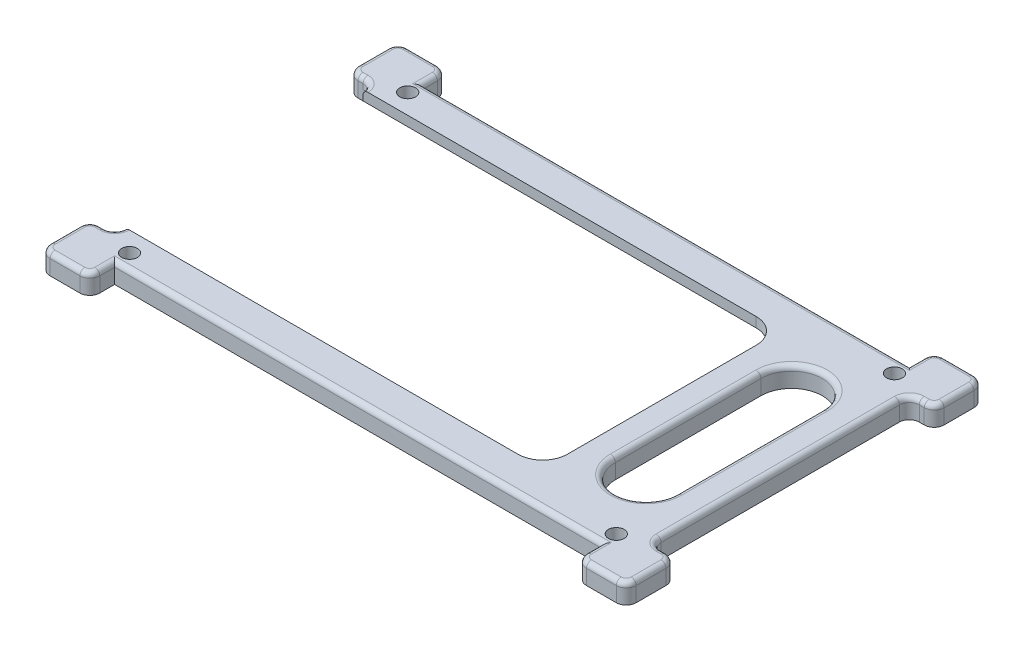
from build123d import *

# Parameters (mm, degrees)
CROQUIS2_R              = 1.5875
SALIENTE_EXTRUIR1_DEPTH = 4
CROQUIS3_W              = 6.440041964
CROQUIS3_H              = 2.682034213
CROQUIS3_W_2            = 39.119916072
CORTAR_EXTRUIR1_DEPTH   = 92
REDONDEO1_R             = 1


with BuildPart() as part:
    # Croquis2 → Saliente-Extruir1 (new body)
    with BuildSketch(Plane(origin=(0, 0, 0), x_dir=(1, 0, 0), z_dir=(0, 1, 0))):
        with BuildLine():
            Line((44.603152988, 28.432107171), (44.603152988, -19.567892829))
            ThreePointArc((44.603152988, -19.567892829), (45.188939426, -20.982106391), (46.603152988, -21.567892829))
            Line((46.603152988, -21.567892829), (47.603152988, -21.567892829))
            ThreePointArc((47.603152988, -21.567892829), (49.01736655, -22.153679266), (49.603152988, -23.567892829))
            Line((49.603152988, -23.567892829), (49.603152988, -29.567892829))
            ThreePointArc((49.603152988, -29.567892829), (49.01736655, -30.982106391), (47.603152988, -31.567892829))
            Line((47.603152988, -31.567892829), (41.603152988, -31.567892829))
            ThreePointArc((41.603152988, -31.567892829), (40.188939426, -30.982106391), (39.603152988, -29.567892829))
            Line((39.603152988, -29.567892829), (39.603152988, -29.067892829))
            Line((39.603152988, -29.067892829), (39.603152988, -26.567892829))
            Line((39.603152988, -26.567892829), (-58.396847012, -26.567892829))
            Line((-58.396847012, -26.567892829), (-58.396847012, -29.067892829))
            Line((-58.396847012, -29.067892829), (-58.396847012, -29.567892829))
            ThreePointArc((-58.396847012, -29.567892829), (-58.98263345, -30.982106391), (-60.396847012, -31.567892829))
            Line((-60.396847012, -31.567892829), (-66.396847012, -31.567892829))
            ThreePointArc((-66.396847012, -31.567892829), (-67.811060574, -30.982106391), (-68.396847012, -29.567892829))
            Line((-68.396847012, -29.567892829), (-68.396847012, -23.567892829))
            ThreePointArc((-68.396847012, -23.567892829), (-67.811060574, -22.153679266), (-66.396847012, -21.567892829))
            Line((-66.396847012, -21.567892829), (-65.396847012, -21.567892829))
            ThreePointArc((-65.396847012, -21.567892829), (-63.98263345, -20.982106391), (-63.396847012, -19.567892829))
            Line((-63.396847012, -19.567892829), (15.776989182, -19.567892829))
            ThreePointArc((15.776989182, -19.567892829), (19.312523088, -18.103426735), (20.776989182, -14.567892829))
            Line((20.776989182, -14.567892829), (20.776989182, 23.432107171))
            ThreePointArc((20.776989182, 23.432107171), (19.312523088, 26.967641077), (15.776989182, 28.432107171))
            Line((15.776989182, 28.432107171), (-63.396847012, 28.432107171))
            ThreePointArc((-63.396847012, 28.432107171), (-63.98263345, 29.846320734), (-65.396847012, 30.432107171))
            Line((-65.396847012, 30.432107171), (-66.396847012, 30.432107171))
            ThreePointArc((-66.396847012, 30.432107171), (-67.811060574, 31.017893609), (-68.396847012, 32.432107171))
            Line((-68.396847012, 32.432107171), (-68.396847012, 38.432107171))
            ThreePointArc((-68.396847012, 38.432107171), (-67.811060574, 39.846320734), (-66.396847012, 40.432107171))
            Line((-66.396847012, 40.432107171), (-60.396847012, 40.432107171))
            ThreePointArc((-60.396847012, 40.432107171), (-58.98263345, 39.846320734), (-58.396847012, 38.432107171))
            Line((-58.396847012, 38.432107171), (-58.396847012, 37.932107171))
            Line((-58.396847012, 37.932107171), (-58.396847012, 35.432107171))
            Line((-58.396847012, 35.432107171), (39.603152988, 35.432107171))
            Line((39.603152988, 35.432107171), (39.603152988, 37.932107171))
            Line((39.603152988, 37.932107171), (39.603152988, 38.432107171))
            ThreePointArc((39.603152988, 38.432107171), (40.188939426, 39.846320734), (41.603152988, 40.432107171))
            Line((41.603152988, 40.432107171), (47.603152988, 40.432107171))
            ThreePointArc((47.603152988, 40.432107171), (49.01736655, 39.846320734), (49.603152988, 38.432107171))
            Line((49.603152988, 38.432107171), (49.603152988, 32.432107171))
            ThreePointArc((49.603152988, 32.432107171), (49.01736655, 31.017893609), (47.603152988, 30.432107171))
            Line((47.603152988, 30.432107171), (46.603152988, 30.432107171))
            ThreePointArc((46.603152988, 30.432107171), (45.188939426, 29.846320734), (44.603152988, 28.432107171))
        make_face()
        with Locations(Location((-58.396847012, 32.432107171, 0), (0, 0, 270))):
            Circle(CROQUIS2_R, mode=Mode.SUBTRACT)
        with Locations(Location((-58.396847012, -23.567892829, 0), (0, 0, 270))):
            Circle(CROQUIS2_R, mode=Mode.SUBTRACT)
        with Locations(Location((39.603152988, -23.567892829, 0), (0, 0, 270))):
            Circle(CROQUIS2_R, mode=Mode.SUBTRACT)
        with Locations(Location((39.603152988, 32.432107171, 0), (0, 0, 270))):
            Circle(CROQUIS2_R, mode=Mode.SUBTRACT)
        with BuildLine():
            Line((38.434260776, 19.08388734), (38.434260776, -10.219672997))
            ThreePointArc((38.434260776, -10.219672997), (32.250588174, -16.403345599), (26.066915572, -10.219672997))
            Line((26.066915572, -10.219672997), (26.066915572, 19.08388734))
            ThreePointArc((26.066915572, 19.08388734), (32.250588174, 25.267559942), (38.434260776, 19.08388734))
        make_face(mode=Mode.SUBTRACT)
    extrude(amount=SALIENTE_EXTRUIR1_DEPTH)

    # Croquis3 → Cortar-Extruir1 (cut)
    with BuildSketch(Plane.ZY.offset(68.396847012)):
        with Locations((-27.212086189, 0.658982893)):
            Rectangle(CROQUIS3_W, CROQUIS3_H)
        with Locations((-4.432107171, 0.658982893)):
            Rectangle(CROQUIS3_W_2, CROQUIS3_H)
        with Locations((18.347871847, 0.658982893)):
            Rectangle(CROQUIS3_W, CROQUIS3_H)
    extrude(amount=-CORTAR_EXTRUIR1_DEPTH, mode=Mode.SUBTRACT)

    # Redondeo1
    redondeo1_edges = [part.edges().sort_by_distance(p)[0] for p in [
        (-9.396847012, 4, 26.567892829),
        (39.603152988, 4, 28.067892829),
        (40.188939426, 4, 30.982106391),
        (44.603152988, 4, 31.567892829),
        (49.01736655, 4, 30.982106391),
        (49.603152988, 4, 26.567892829),
        (49.01736655, 4, 22.153679266),
        (47.103152988, 4, 21.567892829),
        (45.188939426, 4, 20.982106391),
        (44.603152988, 4, -4.432107171),
        (45.188939426, 4, -29.846320734),
        (47.103152988, 4, -30.432107171),
        (49.01736655, 4, -31.017893609),
        (49.603152988, 4, -35.432107171),
        (49.01736655, 4, -39.846320734),
        (44.603152988, 4, -40.432107171),
        (40.188939426, 4, -39.846320734),
        (39.603152988, 4, -36.932107171),
        (-9.396847012, 4, -35.432107171),
        (-58.396847012, 4, -36.932107171),
        (-58.98263345, 4, -39.846320734),
        (-63.396847012, 4, -40.432107171),
        (-67.811060574, 4, -39.846320734),
        (-68.396847012, 4, -35.432107171),
        (-67.811060574, 4, -31.017893609),
        (-65.896847012, 4, -30.432107171),
        (-63.98263345, 4, -29.846320734),
        (32.250588174, 4, 16.403345599),
        (26.066915572, 4, -4.432107171),
        (32.250588174, 4, -25.267559942),
        (38.434260776, 4, -4.432107171),
        (-63.98263345, 4, 20.982106391),
        (-65.896847012, 4, 21.567892829),
        (-67.811060574, 4, 22.153679266),
        (-68.396847012, 4, 26.567892829),
        (-67.811060574, 4, 30.982106391),
        (-63.396847012, 4, 31.567892829),
        (-58.98263345, 4, 30.982106391),
        (-58.396847012, 4, 28.067892829),
    ]]
    fillet(redondeo1_edges, radius=REDONDEO1_R)


solid = part.part
